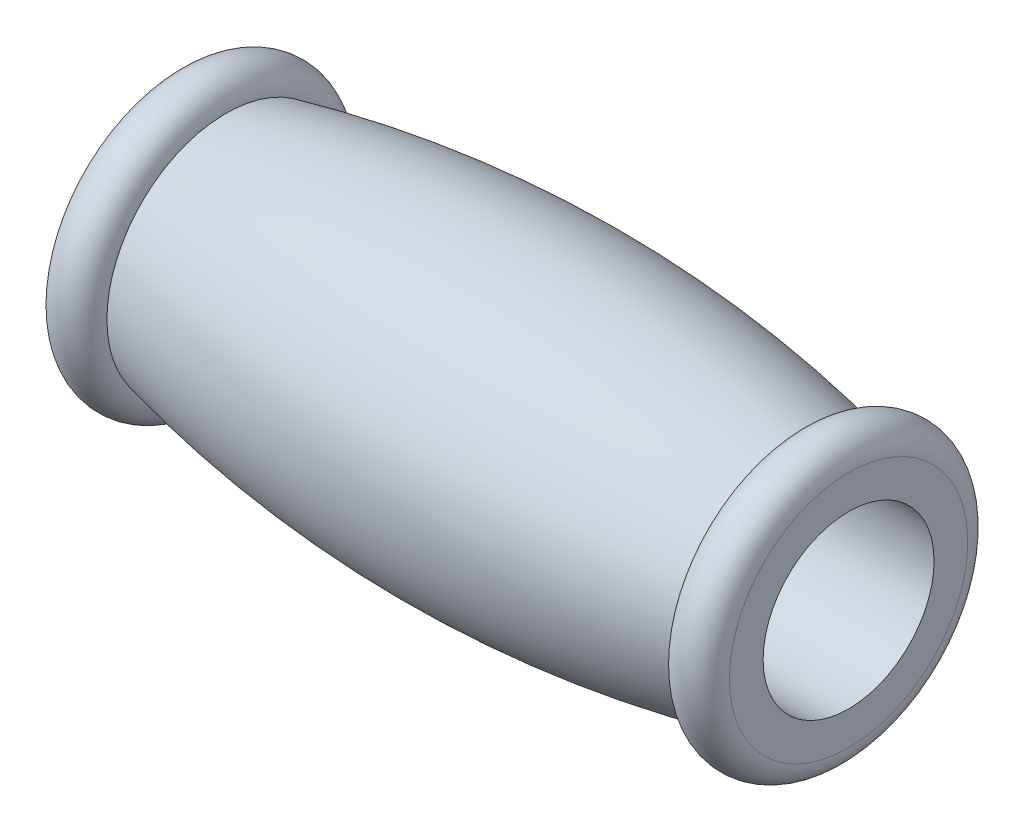
from build123d import *


with BuildPart() as part:
    # Sketch1 → Revolve1 (revolve)
    with BuildSketch(Plane.XY, mode=Mode.PRIVATE) as revolve1_sk:
        with BuildLine():
            Line((-50, 12.7), (50, 12.7))
            Line((50, 12.7), (50, 17.7))
            ThreePointArc((50, 17.7), (46.25, 21.45), (42.5, 17.7))
            ThreePointArc((42.5, 17.7), (0, 22.529313385), (-42.5, 17.7))
            ThreePointArc((-42.5, 17.7), (-46.25, 21.45), (-50, 17.7))
            Line((-50, 17.7), (-50, 12.7))
        make_face()
    revolve(revolve1_sk.sketch.rotate(Axis((-100, 0, 0), (1, 0, 0)), 90), axis=Axis((-100, 0, 0), (1, 0, 0)))


solid = part.part
